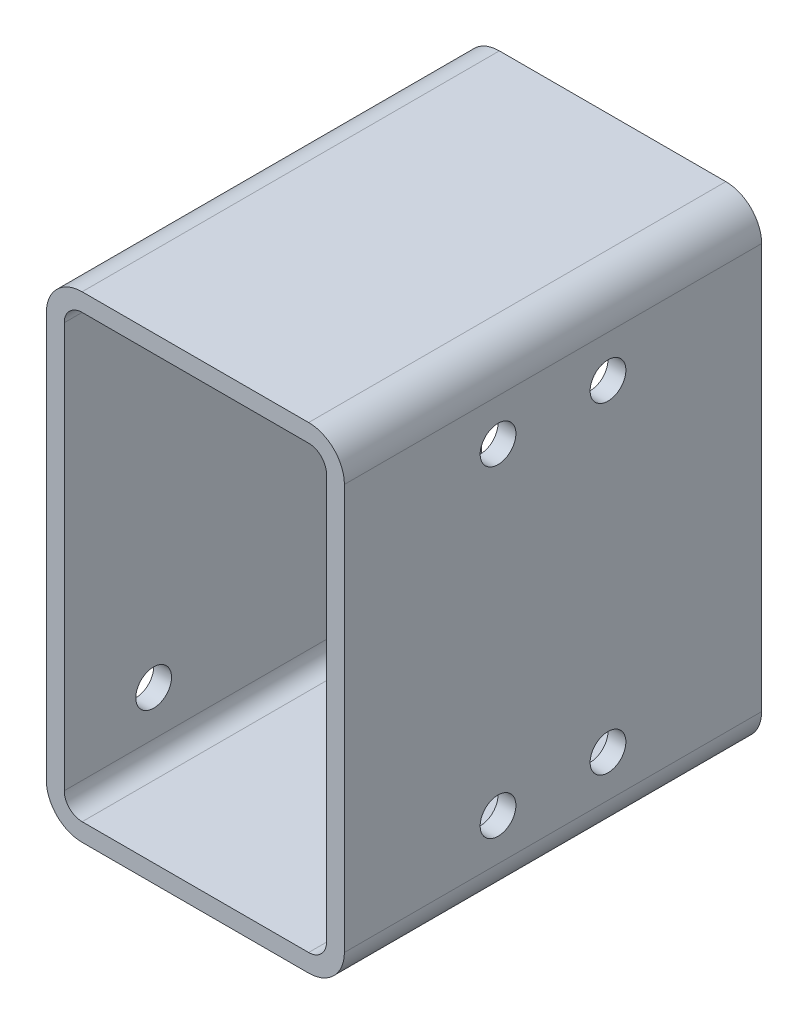
from build123d import *

# Parameters (mm, degrees)
BOSS_EXTRUDE4_DEPTH = 35
SKETCH11_R          = 3
CUT_EXTRUDE7_DEPTH  = 20
SKETCH12_R          = 3
CUT_EXTRUDE8_DEPTH  = 20


with BuildPart() as part:
    # Sketch9 → Boss-Extrude4 (new, symmetric)
    with BuildSketch(Plane.XY):
        with BuildLine():
            Line((19, 40), (-19, 40))
            ThreePointArc((-19, 40), (-23.242640687, 38.242640687), (-25, 34))
            Line((-25, 34), (-25, -34))
            ThreePointArc((-25, -34), (-23.242640687, -38.242640687), (-19, -40))
            Line((-19, -40), (19, -40))
            ThreePointArc((19, -40), (23.242640687, -38.242640687), (25, -34))
            Line((25, -34), (25, 34))
            ThreePointArc((25, 34), (23.242640687, 38.242640687), (19, 40))
        make_face()
        with BuildLine():
            Line((22, -34), (22, 34))
            ThreePointArc((22, 34), (21.121320344, 36.121320344), (19, 37))
            Line((19, 37), (-19, 37))
            ThreePointArc((-19, 37), (-21.121320344, 36.121320344), (-22, 34))
            Line((-22, 34), (-22, -34))
            ThreePointArc((-22, -34), (-21.121320344, -36.121320344), (-19, -37))
            Line((-19, -37), (19, -37))
            ThreePointArc((19, -37), (21.121320344, -36.121320344), (22, -34))
        make_face(mode=Mode.SUBTRACT)
    extrude(amount=BOSS_EXTRUDE4_DEPTH, both=True)

    # Sketch11 → Cut-Extrude7 (cut)
    with BuildSketch(Plane.ZY.offset(25)):
        with Locations(Location((-20, 26.5, 0), (0, 0, 270))):
            Circle(SKETCH11_R)
        with Locations(Location((20, 26.5, 0), (0, 0, 270))):
            Circle(SKETCH11_R)
        with Locations(Location((20, -26.5, 0), (0, 0, 270))):
            Circle(SKETCH11_R)
        with Locations(Location((-20, -26.5, 0), (0, 0, 270))):
            Circle(SKETCH11_R)
    extrude(amount=-CUT_EXTRUDE7_DEPTH, mode=Mode.SUBTRACT)

    # Sketch12 → Cut-Extrude8 (cut)
    with BuildSketch(Plane(origin=(25, 0, 0), x_dir=(0, 0, -1), z_dir=(1, 0, 0))):
        with Locations(Location((-9.225, 27, 0), (0, 0, 90))):
            Circle(SKETCH12_R)
        with Locations(Location((9.225, 27, 0), (0, 0, 90))):
            Circle(SKETCH12_R)
        with Locations(Location((9.225, -27, 0), (0, 0, 90))):
            Circle(SKETCH12_R)
        with Locations(Location((-9.225, -27, 0), (0, 0, 90))):
            Circle(SKETCH12_R)
    extrude(amount=-CUT_EXTRUDE8_DEPTH, mode=Mode.SUBTRACT)


solid = part.part
